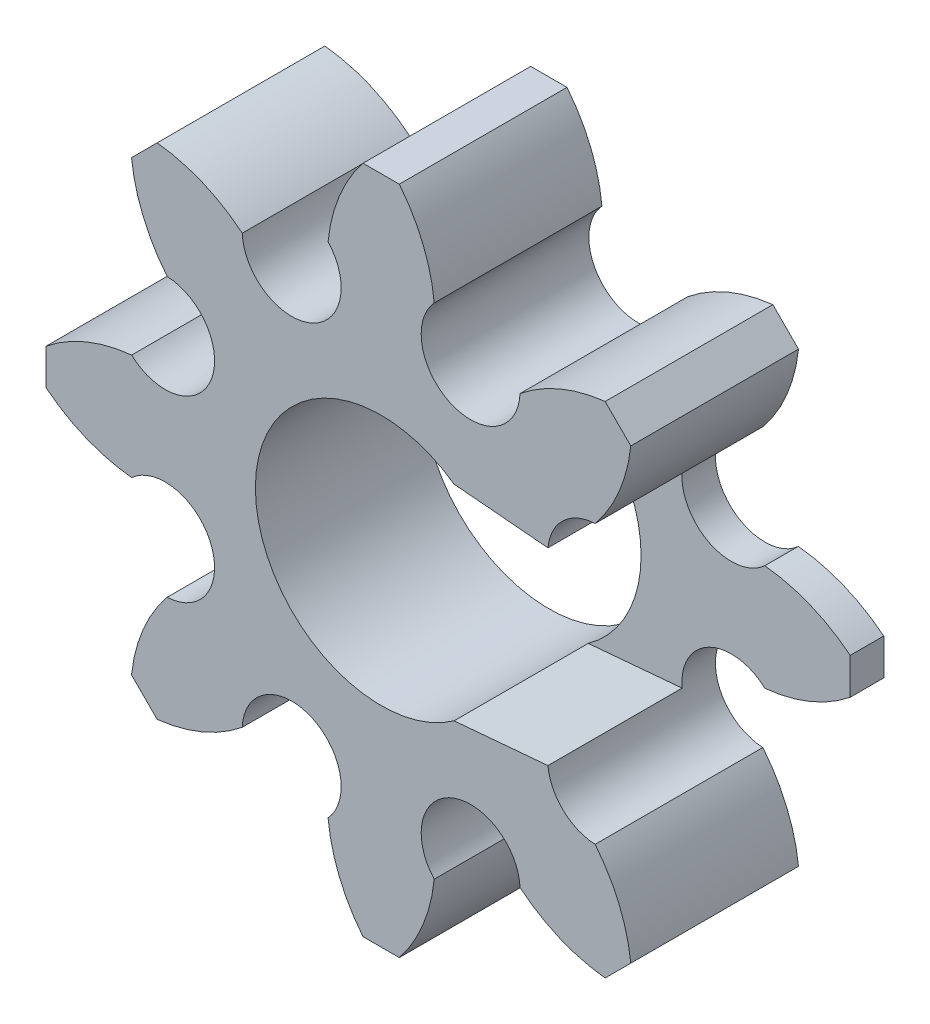
from build123d import *

# Parameters (mm, degrees)
SKETCH1_R           = 3.75
BOSS_EXTRUDE1_DEPTH = 5
CUT_EXTRUDE1_DEPTH  = 4


with BuildPart() as part:
    # Sketch1 → Boss-Extrude1 (new body)
    with BuildSketch(Plane.XY):
        with BuildLine():
            Line((9.558996201, 20.085353851), (10.641002655, 20.085353851))
            ThreePointArc((10.641002655, 20.085353851), (11.348612191, 18.888750883), (11.682733536, 17.539331436))
            ThreePointArc((11.682733536, 17.539331436), (12.203470274, 15.178225243), (14.241240442, 16.479563766))
            ThreePointArc((14.241240442, 16.479563766), (15.432774832, 17.194885225), (16.778165126, 17.543258511))
            Line((16.778165126, 17.543258511), (17.543259228, 16.77816441))
            ThreePointArc((17.543259228, 16.77816441), (17.197488656, 15.431682836), (16.479564483, 14.241239725))
            ThreePointArc((16.479564483, 14.241239725), (15.178226761, 12.203469046), (17.539333159, 11.682733236))
            ThreePointArc((17.539333159, 11.682733236), (18.887683861, 11.345999843), (20.085355575, 10.641002355))
            Line((20.085355575, 10.641002355), (20.085355575, 9.558995901))
            ThreePointArc((20.085355575, 9.558995901), (18.888752607, 8.851386365), (17.539333159, 8.51726502))
            ThreePointArc((17.539333159, 8.51726502), (15.178226966, 7.996528282), (16.479565489, 5.958758114))
            ThreePointArc((16.479565489, 5.958758114), (17.194886948, 4.767223724), (17.543260234, 3.42183343))
            Line((17.543260234, 3.42183343), (16.778166133, 2.656739328))
            ThreePointArc((16.778166133, 2.656739328), (15.431684559, 3.0025099), (14.241241448, 3.720434073))
            ThreePointArc((14.241241448, 3.720434073), (12.203470769, 5.021771795), (11.682734959, 2.660665397))
            ThreePointArc((11.682734959, 2.660665397), (11.346001566, 1.312314695), (10.641004079, 0.114642981))
            Line((10.641004079, 0.114642981), (9.558997624, 0.114642981))
            ThreePointArc((9.558997624, 0.114642981), (8.851388089, 1.311245949), (8.517266743, 2.660665397))
            ThreePointArc((8.517266743, 2.660665397), (7.996530005, 5.02177159), (5.958759838, 3.720433067))
            ThreePointArc((5.958759838, 3.720433067), (4.767225448, 3.005111608), (3.421835153, 2.656738322))
            Line((3.421835153, 2.656738322), (2.656741052, 3.421832423))
            ThreePointArc((2.656741052, 3.421832423), (3.002511624, 4.768313997), (3.720435797, 5.958757108))
            ThreePointArc((3.720435797, 5.958757108), (5.021773518, 7.996527787), (2.66066712, 8.517263597))
            ThreePointArc((2.66066712, 8.517263597), (1.312316418, 8.85399699), (0.114644705, 9.558994477))
            Line((0.114644705, 9.558994477), (0.114644705, 10.641000932))
            ThreePointArc((0.114644705, 10.641000932), (1.311247673, 11.348610467), (2.66066712, 11.682731813))
            ThreePointArc((2.66066712, 11.682731813), (5.021773313, 12.203468551), (3.72043479, 14.241238718))
            ThreePointArc((3.72043479, 14.241238718), (3.005113331, 15.432773108), (2.656740045, 16.778163403))
            Line((2.656740045, 16.778163403), (3.421834146, 17.543257504))
            ThreePointArc((3.421834146, 17.543257504), (4.76831572, 17.197486932), (5.958758831, 16.479562759))
            ThreePointArc((5.958758831, 16.479562759), (7.99652951, 15.178225038), (8.51726532, 17.539331436))
            ThreePointArc((8.51726532, 17.539331436), (8.853998713, 18.887682137), (9.558996201, 20.085353851))
        make_face()
        with Locations((10.099999428, 10.099999428)):
            Circle(SKETCH1_R, mode=Mode.SUBTRACT)
    extrude(amount=BOSS_EXTRUDE1_DEPTH)

    # Sketch2 → Cut-Extrude1 (cut)
    with BuildSketch(Plane.XY.offset(5)):
        Polygon((12.190990541, 13.162654627), (12.274208264, 7.044624502), (15.074227333, 7.289583683), (15.112805831, 7.292958716), (23.65344112, 8.040134707), (23.65344112, 12.159866086), (15.074227333, 12.910415649), align=None)
    extrude(amount=-CUT_EXTRUDE1_DEPTH, mode=Mode.SUBTRACT)


solid = part.part
